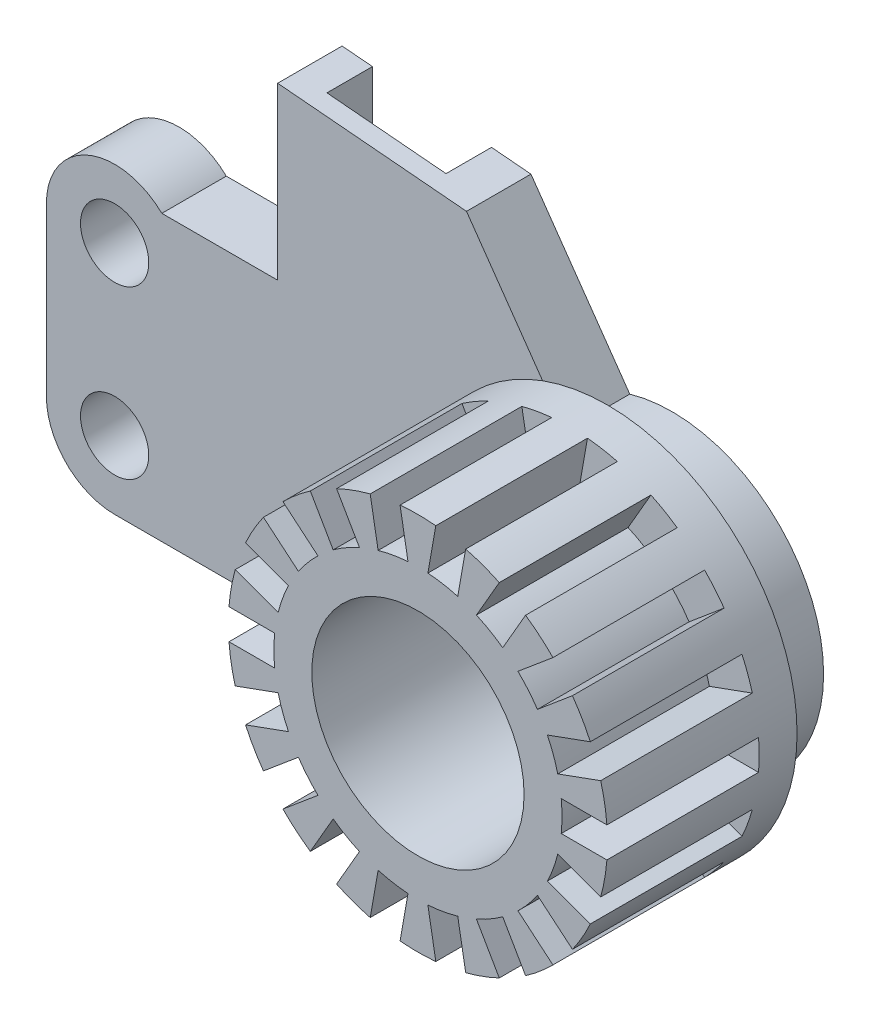
from build123d import *

# Parameters (mm, degrees)
CUT_EXTRUDE1_DEPTH  = 20
CIRPATTERN1_COUNT   = 18
BOSS_EXTRUDE1_START = -8.5
SKETCH3_R           = 4.5
BOSS_EXTRUDE1_DEPTH = 8.5
CUT_EXTRUDE2_START  = -6
CUT_EXTRUDE2_DEPTH  = 6


with BuildPart() as part:
    # Sketch1 → Revolve2 (revolve)
    with BuildSketch(Plane(origin=(0, 0, 0), x_dir=(1, 0, 0), z_dir=(0, 1, 0)), mode=Mode.PRIVATE) as revolve2_sk:
        Polygon((-25, 0), (-14, 0), (-14, 28.5), (-15.5, 28.5), (-15.5, 33.5), (-20, 33.5), (-20, 25), (-25, 25), align=None)
    revolve(revolve2_sk.sketch.rotate(Axis((0, 0, 0), (0, 0, -1)), 180), axis=Axis((0, 0, 0), (0, 0, -1)))

    # Sketch2 → Cut-Extrude1 (cut)
    with BuildSketch(Plane.XY):
        with BuildLine():
            Line((18.894443628, 2), (24.919871589, 2))
            ThreePointArc((24.919871589, 2), (25, 0), (24.919871589, -2))
            Line((24.919871589, -2), (18.894443628, -2))
            ThreePointArc((18.894443628, -2), (19, 0), (18.894443628, 2))
        make_face()
    cut_extrude1 = extrude(amount=-CUT_EXTRUDE1_DEPTH, mode=Mode.SUBTRACT)

    # CirPattern1: Cut-Extrude1 ×18 about axis
    cirpattern1_axis = Axis((0, 0, 0), (0, 0, 1))
    for i in range(1, CIRPATTERN1_COUNT):
        add(cut_extrude1.rotate(cirpattern1_axis, i * 360 / CIRPATTERN1_COUNT), mode=Mode.SUBTRACT)

    # Sketch3 → Boss-Extrude1 (add)
    with BuildSketch(Plane(origin=(0, 0, -33.5), x_dir=(-1, 0, 0), z_dir=(0, 0, -1)).offset(BOSS_EXTRUDE1_START)):
        with BuildLine():
            Line((0, -20), (65, -20))
            ThreePointArc((65, -20), (71.363961031, -17.363961031), (74, -11))
            Line((74, -11), (74, 11))
            ThreePointArc((74, 11), (68.53379766, 19.277214151), (58.775050201, 17.5))
            Line((58.775050201, 17.5), (43.5, 17.5))
            Line((43.5, 17.5), (43.5, 40))
            Line((43.5, 40), (18.595132548, 37.821106431))
            Line((18.595132548, 37.821106431), (5.563850354, 19.210506741))
            ThreePointArc((5.563850354, 19.210506741), (19.801643048, -2.809792268), (0, -20))
        make_face()
        with Locations((65, 11)):
            Circle(SKETCH3_R, mode=Mode.SUBTRACT)
        with Locations((65, -11)):
            Circle(SKETCH3_R, mode=Mode.SUBTRACT)
    extrude(amount=BOSS_EXTRUDE1_DEPTH)

    # Sketch6 → Cut-Extrude2 (cut)
    with BuildSketch(Plane(origin=(0, 0, -33.5), x_dir=(-1, 0, 0), z_dir=(0, 0, -1)).offset(CUT_EXTRUDE2_START)):
        with BuildLine():
            Line((20.784609691, -16), (52.038518603, -16))
            ThreePointArc((52.038518603, -16), (54.973716146, -14.717464882), (56.026666725, -11.692307692))
            ThreePointArc((56.026666725, -11.692307692), (58.395805529, -4.885704016), (65, -2))
            Line((65, -2), (70, -2))
            Line((70, -2), (70, 2))
            Line((70, 2), (65, 2))
            ThreePointArc((65, 2), (59.014440454, 4.278908056), (56.06011199, 9.961538462))
            ThreePointArc((56.06011199, 9.961538462), (54.747077117, 12.487151975), (52.08682843, 13.5))
            Line((52.08682843, 13.5), (42.938553963, 13.5))
            Line((42.938553963, 13.5), (22.520523512, 6.068444673))
            ThreePointArc((22.520523512, 6.068444673), (20.505273991, 4.44346834), (19.907170071, 1.924728492))
            ThreePointArc((19.907170071, 1.924728492), (19.545454521, -4.239717862), (17.320508076, -10))
            ThreePointArc((17.320508076, -10), (17.320508076, -14), (20.784609691, -16))
        make_face()
        with BuildLine():
            Line((23.79689183, 38.276201399), (11.721526755, 21.030792837))
            ThreePointArc((11.721526755, 21.030792837), (11.038650101, 18.16861398), (12.498445777, 15.613739243))
            ThreePointArc((12.498445777, 15.613739243), (14.650735805, 13.614548849), (16.486968638, 11.3216547))
            ThreePointArc((16.486968638, 11.3216547), (18.564157588, 9.776641825), (21.152442938, 9.827215157))
            Line((21.152442938, 9.827215157), (36.868080573, 15.547239468))
            ThreePointArc((36.868080573, 15.547239468), (38.776608177, 17.011704206), (39.5, 19.306009951))
            Line((39.5, 19.306009951), (39.5, 39.650045346))
            Line((39.5, 39.650045346), (23.79689183, 38.276201399))
        make_face()
    extrude(amount=CUT_EXTRUDE2_DEPTH, mode=Mode.SUBTRACT)


solid = part.part
